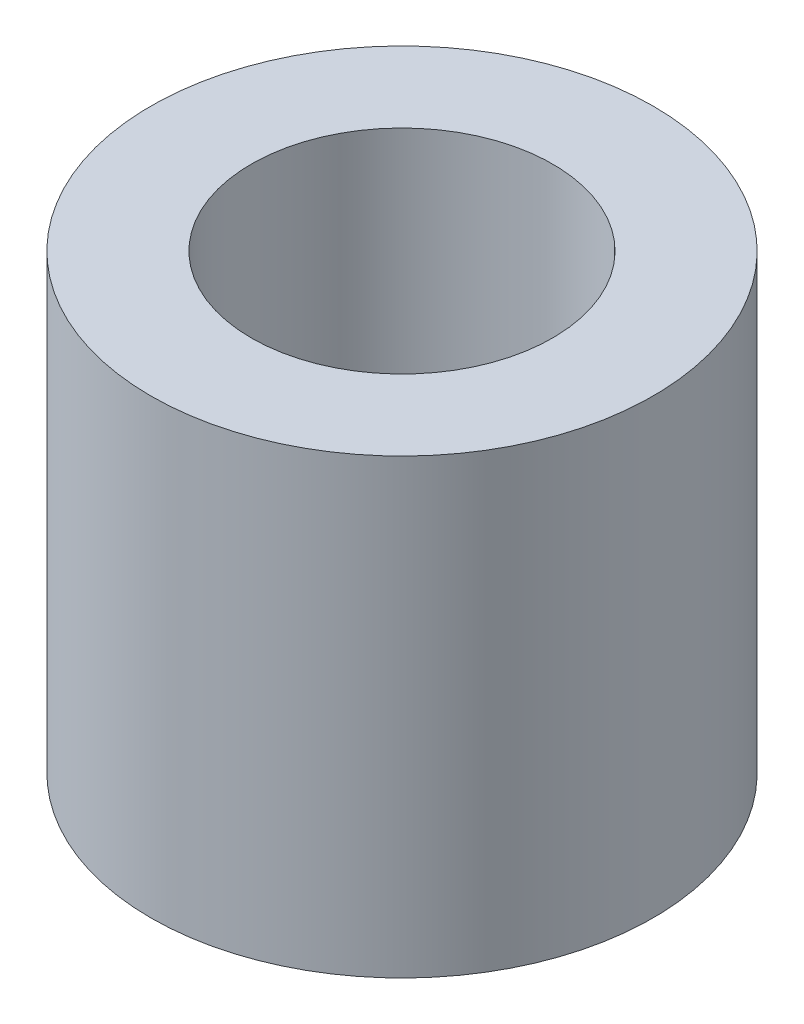
from build123d import *

# Parameters (mm, degrees)
BOSS_EXTRUDE1_DEPTH      = 4.5
BOSS_EXTRUDE1_DEPTH_BACK = 4.5
SKETCH1_R                = 5
SKETCH1_R_2              = 3


with BuildPart() as part:
    # Sketch1 → Boss-Extrude1 (new, two sides: drawn at the far end of the back side and taken through both)
    with BuildSketch(Plane(origin=(0, 0, 0), x_dir=(1, 0, 0), z_dir=(0, 1, 0)).offset(-BOSS_EXTRUDE1_DEPTH_BACK)):
        Circle(SKETCH1_R)
        Circle(SKETCH1_R_2, mode=Mode.SUBTRACT)
    extrude(amount=BOSS_EXTRUDE1_DEPTH + BOSS_EXTRUDE1_DEPTH_BACK)


solid = part.part
